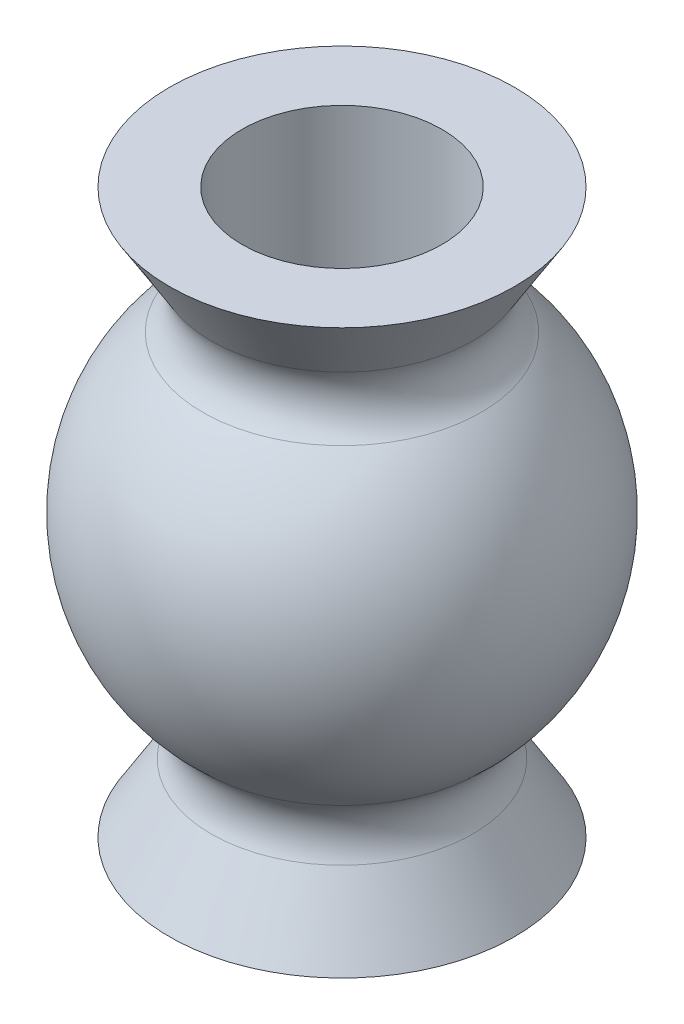
from build123d import *

# Parameters (mm, degrees)
FILLET1_R = 0.635


with BuildPart() as part:
    # Sketch1 → Revolve1 (revolve)
    with BuildSketch(Plane.XY):
        with BuildLine():
            Line((-1.397, 7.874), (-2.413, 7.874))
            Line((-2.413, 7.874), (-1.524, 6.428919943))
            ThreePointArc((-1.524, 6.428919943), (-2.921, 3.937), (-1.524, 1.445080057))
            Line((-1.524, 1.445080057), (-2.413, 0))
            Line((-2.413, 0), (-1.397, 0))
            Line((-1.397, 0), (-1.397, 7.874))
        make_face()
    revolve(axis=Axis((0, 0, 0), (0, 1, 0)))

    # Fillet1
    fillet1_edges = [part.edges().sort_by_distance(p)[0] for p in [
        (1.524, 1.445080057, 0),
        (1.524, 6.428919943, 0),
    ]]
    fillet(fillet1_edges, radius=FILLET1_R)


solid = part.part
